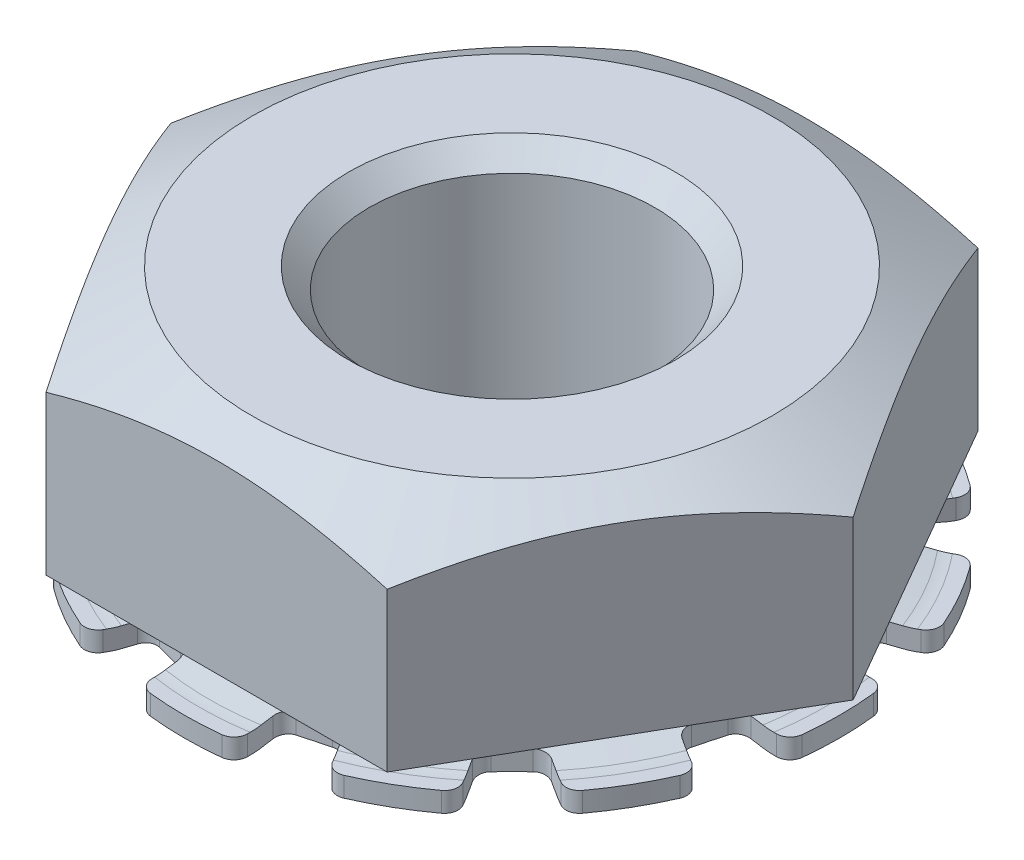
from build123d import *
from build123d.topology import SkipClean

# Parameters (mm, degrees)
EXTRUDE_2_REACH          = 9.409
FILLET_1_R               = 1
CUT_EXTRUDE_1_REACH      = 9.786
PATTERN_CIRCULAR_1_COUNT = 12
FILLET_2_R               = 0.2


with BuildPart() as part:
    # 草图1 → 旋转1 (revolve)
    with BuildSketch(Plane.XY):
        Polygon((2.085, 3.28), (2.085, 0), (2.685, 0), (2.685, 0.29), (2.375, 0.29), (2.375, 0.58), (4.318, 0.58), (4.318, 3.28), (3.798384758, 3.58), (2.385, 3.58), align=None)
    revolve(axis=Axis((0, -97.506361361, 0), (0, 1, 0)))

    # 草图1<3> → 旋转2 (revolve)
    with BuildSketch(Plane.XY):
        Polygon((2.375, 0.29), (2.685, 0.29), (4.5, 0), (4.79, 0), (4.79, 0.29), (4.5, 0.29), (2.685, 0.58), (2.375, 0.58), align=None)
    revolve(axis=Axis((0, -97.506361361, 0), (0, 1, 0)))

    # 凸台-拉伸2: up to this cone (the profile starts inside it)
    with SkipClean():  # the faces are left unmerged after this step: merging them gives an invalid solid
        extrude_2_end = Plane(origin=(0, 0.58, 0), z_dir=(0, -1, 0)).offset(-5.192997462) * Cone(1.732e-06, 41.73642402, 24.096534643, align=(Align.CENTER, Align.CENTER, Align.MIN), mode=Mode.PRIVATE)
        # 草图2 → 凸台-拉伸2 (add, up to the surface)
        with BuildSketch(Plane(origin=(0, 0.58, 0), x_dir=(1, 0, 0), z_dir=(0, 1, 0)), mode=Mode.PRIVATE) as extrude_2_sk1:
            with BuildLine():
                ThreePointArc((-3.739497685, -2.159000016), (-4.318, 2.3e-08), (-3.739497662, 2.159000055))
                Line((-3.739497662, 2.159000055), (-4.985996925, 0))
                Line((-4.985996925, 0), (-3.739497685, -2.159000016))
            make_face()
        extrude_2_tool1 = extrude(extrude_2_sk1.sketch, amount=EXTRUDE_2_REACH, mode=Mode.PRIVATE) & extrude_2_end
        add(extrude_2_tool1.solids().sort_by_distance((-4.462925, 0.58, 0))[0])
        # 草图2 → 凸台-拉伸2 (add, up to the surface)
        with BuildSketch(Plane(origin=(0, 0.58, 0), x_dir=(1, 0, 0), z_dir=(0, 1, 0)), mode=Mode.PRIVATE) as extrude_2_sk2:
            with BuildLine():
                Line((-2.492998462, -4.318), (0, -4.318))
                ThreePointArc((0, -4.318), (-2.158999992, -3.739497698), (-3.739497685, -2.159000016))
                Line((-3.739497685, -2.159000016), (-2.492998462, -4.318))
            make_face()
        extrude_2_tool2 = extrude(extrude_2_sk2.sketch, amount=EXTRUDE_2_REACH, mode=Mode.PRIVATE) & extrude_2_end
        add(extrude_2_tool2.solids().sort_by_distance((-2.231463, 0.58, 3.865006))[0])
        # 草图2 → 凸台-拉伸2 (add, up to the surface)
        with BuildSketch(Plane(origin=(0, 0.58, 0), x_dir=(1, 0, 0), z_dir=(0, 1, 0)), mode=Mode.PRIVATE) as extrude_2_sk3:
            with BuildLine():
                Line((2.492998462, -4.318), (3.739497685, -2.159000016))
                ThreePointArc((3.739497685, -2.159000016), (2.158999992, -3.739497698), (0, -4.318))
                Line((0, -4.318), (2.492998462, -4.318))
            make_face()
        extrude_2_tool3 = extrude(extrude_2_sk3.sketch, amount=EXTRUDE_2_REACH, mode=Mode.PRIVATE) & extrude_2_end
        add(extrude_2_tool3.solids().sort_by_distance((2.231463, 0.58, 3.865006))[0])
        # 草图2 → 凸台-拉伸2 (add, up to the surface)
        with BuildSketch(Plane(origin=(0, 0.58, 0), x_dir=(1, 0, 0), z_dir=(0, 1, 0)), mode=Mode.PRIVATE) as extrude_2_sk4:
            with BuildLine():
                Line((3.739497685, -2.159000016), (4.985996925, 0))
                Line((4.985996925, 0), (3.73949766, 2.159000059))
                ThreePointArc((3.73949766, 2.159000059), (4.170867709, 1.11758067), (4.318, 0))
                ThreePointArc((4.318, 0), (4.170867716, -1.117580645), (3.739497685, -2.159000016))
            make_face()
        extrude_2_tool4 = extrude(extrude_2_sk4.sketch, amount=EXTRUDE_2_REACH, mode=Mode.PRIVATE) & extrude_2_end
        add(extrude_2_tool4.solids().sort_by_distance((4.462925, 0.58, 0))[0])
        # 草图2 → 凸台-拉伸2 (add, up to the surface)
        with BuildSketch(Plane(origin=(0, 0.58, 0), x_dir=(1, 0, 0), z_dir=(0, 1, 0)), mode=Mode.PRIVATE) as extrude_2_sk5:
            with BuildLine():
                ThreePointArc((5e-09, 4.318), (2.158999973, 3.739497709), (3.73949766, 2.159000059))
                Line((3.73949766, 2.159000059), (2.492998462, 4.318))
                Line((2.492998462, 4.318), (5e-09, 4.318))
            make_face()
        extrude_2_tool5 = extrude(extrude_2_sk5.sketch, amount=EXTRUDE_2_REACH, mode=Mode.PRIVATE) & extrude_2_end
        add(extrude_2_tool5.solids().sort_by_distance((2.231463, 0.58, -3.865006))[0])
        # 草图2 → 凸台-拉伸2 (add, up to the surface)
        with BuildSketch(Plane(origin=(0, 0.58, 0), x_dir=(1, 0, 0), z_dir=(0, 1, 0)), mode=Mode.PRIVATE) as extrude_2_sk6:
            with BuildLine():
                ThreePointArc((-3.739497662, 2.159000055), (-2.15899997, 3.739497711), (5e-09, 4.318))
                Line((5e-09, 4.318), (-2.492998462, 4.318))
                Line((-2.492998462, 4.318), (-3.739497662, 2.159000055))
            make_face()
        extrude_2_tool6 = extrude(extrude_2_sk6.sketch, amount=EXTRUDE_2_REACH, mode=Mode.PRIVATE) & extrude_2_end
        add(extrude_2_tool6.solids().sort_by_distance((-2.231463, 0.58, -3.865006))[0])

    # 圆角1
    fillet_1_edges = [part.edges().sort_by_distance(p)[0] for p in [
        (-4.5, 0, 0),
        (-4.5, 0.29, 0),
    ]]
    fillet(fillet_1_edges, radius=FILLET_1_R)

    # 草图3 → 切除-拉伸1 (cut, up to next)
    with BuildSketch(Plane(origin=(0, 0, 0), x_dir=(1, 0, 0), z_dir=(0, 1, 0)), mode=Mode.PRIVATE) as cut_extrude_1_sk1:
        with BuildLine():
            Line((-0.698541667, 4.738790937), (-0.698541667, 4.04024927))
            Line((-0.698541667, 4.04024927), (-1.056855736, 3.944239304))
            Line((-1.056855736, 3.944239304), (-1.239743226, 4.626784708))
            ThreePointArc((-1.239743226, 4.626784708), (-0.970759203, 4.690599809), (-0.698541667, 4.738790937))
        make_face()
    cut_extrude_1_tool1 = extrude(cut_extrude_1_sk1.sketch, amount=CUT_EXTRUDE_1_REACH, mode=Mode.PRIVATE) & part.part
    # 草图3 → 切除-拉伸1 (cut, up to next)
    with BuildSketch(Plane(origin=(0, 0, 0), x_dir=(1, 0, 0), z_dir=(0, 1, 0)), mode=Mode.PRIVATE) as cut_extrude_1_sk2:
        with BuildLine():
            Line((0.698541667, 4.04024927), (0.698541667, 4.738790937))
            ThreePointArc((0.698541667, 4.738790937), (0.970759203, 4.690599809), (1.239743226, 4.626784708))
            Line((1.239743226, 4.626784708), (1.056855736, 3.944239304))
            Line((1.056855736, 3.944239304), (0.698541667, 4.04024927))
        make_face()
    cut_extrude_1_tool2 = extrude(cut_extrude_1_sk2.sketch, amount=CUT_EXTRUDE_1_REACH, mode=Mode.PRIVATE) & part.part
    cut_extrude_1_1 = cut_extrude_1_tool1.solids().sort_by_distance((-0.928229, 0, -4.363128))[0]
    add(cut_extrude_1_1, mode=Mode.SUBTRACT)
    cut_extrude_1_2 = cut_extrude_1_tool2.solids().sort_by_distance((0.928229, 0, -4.363128))[0]
    add(cut_extrude_1_2, mode=Mode.SUBTRACT)
    cut_extrude_1 = cut_extrude_1_1 + cut_extrude_1_2  # 切除-拉伸1 as one shape, for the pattern or mirror that repeats it

    # 阵列(圆周)1: 切除-拉伸1 ×12 about axis
    with SkipClean():  # the faces are left unmerged after this step: merging them gives an invalid solid
        pattern_circular_1_axis = Axis((0, 0, 0), (0, 1, 0))
        for i in range(1, PATTERN_CIRCULAR_1_COUNT):
            add(cut_extrude_1.rotate(pattern_circular_1_axis, i * 360 / PATTERN_CIRCULAR_1_COUNT), mode=Mode.SUBTRACT)

    # 圆角2
    fillet_2_edges = [part.edges().sort_by_distance(p)[0] for p in [
        (-0.698541667, 0.208881164, -4.04024927),
        (-0.698541667, 0.145, -4.738790937),
        (0.698541667, 0.208881164, -4.04024927),
        (0.698541667, 0.145, -4.738790937),
        (2.625079464, 0.208881164, 3.149687672),
        (3.149687672, 0.208881164, 2.625079464),
        (2.974350297, 0.145, 3.754642501),
        (3.754642501, 0.145, 2.974350297),
        (0.698541667, 0.208881164, 4.04024927),
        (1.415169806, 0.208881164, 3.848229339),
        (0.698541667, 0.145, 4.738790937),
        (1.764440639, 0.145, 4.453184168),
        (4.04024927, 0.208881164, -0.698541667),
        (3.848229339, 0.208881164, -1.415169806),
        (4.738790937, 0.145, -0.698541667),
        (4.453184168, 0.145, -1.764440639),
        (3.848229339, 0.208881164, 1.415169806),
        (4.04024927, 0.208881164, 0.698541667),
        (4.453184168, 0.145, 1.764440639),
        (4.738790937, 0.145, 0.698541667),
        (-4.04024927, 0.208881164, 0.698541667),
        (-3.848229339, 0.208881164, 1.415169806),
        (-4.738790937, 0.145, 0.698541667),
        (-4.453184168, 0.145, 1.764440639),
        (-3.848229339, 0.208881164, -1.415169806),
        (-4.04024927, 0.208881164, -0.698541667),
        (-4.453184168, 0.145, -1.764440639),
        (-4.738790937, 0.145, -0.698541667),
        (-1.415169806, 0.208881164, -3.848229339),
        (-1.764440639, 0.145, -4.453184168),
        (-1.415169806, 0.208881164, 3.848229339),
        (-0.698541667, 0.208881164, 4.04024927),
        (-1.764440639, 0.145, 4.453184168),
        (-0.698541667, 0.145, 4.738790937),
        (-3.149687672, 0.208881164, 2.625079464),
        (-2.625079464, 0.208881164, 3.149687672),
        (-3.754642501, 0.145, 2.974350297),
        (-2.974350297, 0.145, 3.754642501),
        (3.149687672, 0.208881164, -2.625079464),
        (2.625079464, 0.208881164, -3.149687672),
        (3.754642501, 0.145, -2.974350297),
        (2.974350297, 0.145, -3.754642501),
        (1.415169806, 0.208881164, -3.848229339),
        (1.764440639, 0.145, -4.453184168),
        (-2.625079464, 0.208881164, -3.149687672),
        (-3.149687672, 0.208881164, -2.625079464),
        (-2.974350297, 0.145, -3.754642501),
        (-3.754642501, 0.145, -2.974350297),
    ]]
    fillet(fillet_2_edges, radius=FILLET_2_R)


solid = part.part
